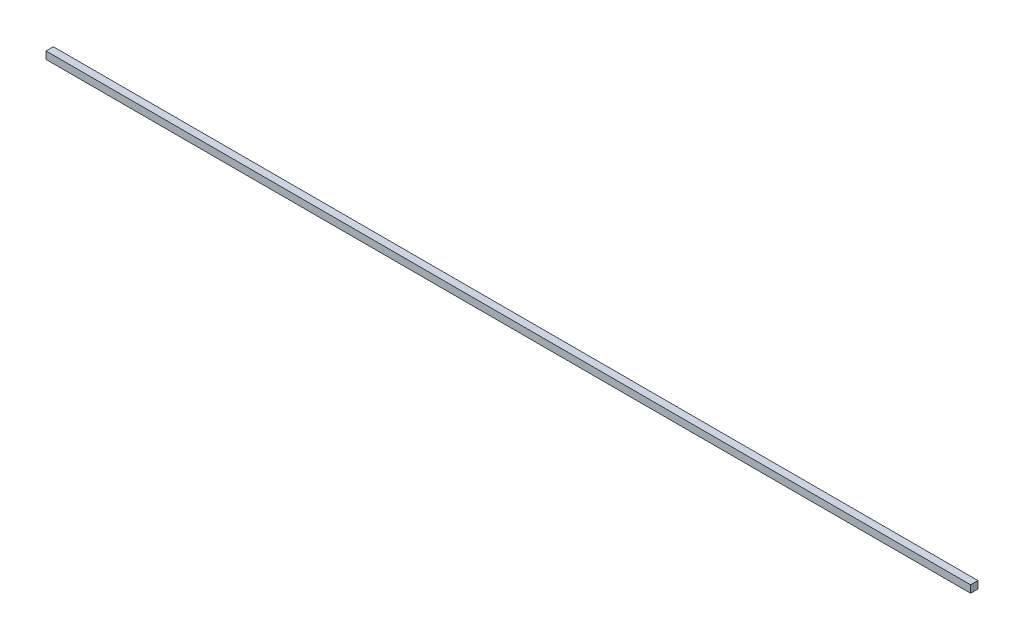
from build123d import *

# Parameters (mm, degrees)
SKIZZE1_W                       = 5035
SKIZZE1_H                       = 40
AUFSATZ_LINEAR_AUSTRAGEN1_DEPTH = 40


with BuildPart() as part:
    # Skizze1 → Aufsatz-Linear austragen1 (new body)
    with BuildSketch(Plane(origin=(0, 0, 0), x_dir=(1, 0, 0), z_dir=(0, 1, 0))):
        with Locations((2517.5, 20)):
            Rectangle(SKIZZE1_W, SKIZZE1_H)
    extrude(amount=AUFSATZ_LINEAR_AUSTRAGEN1_DEPTH)


solid = part.part
